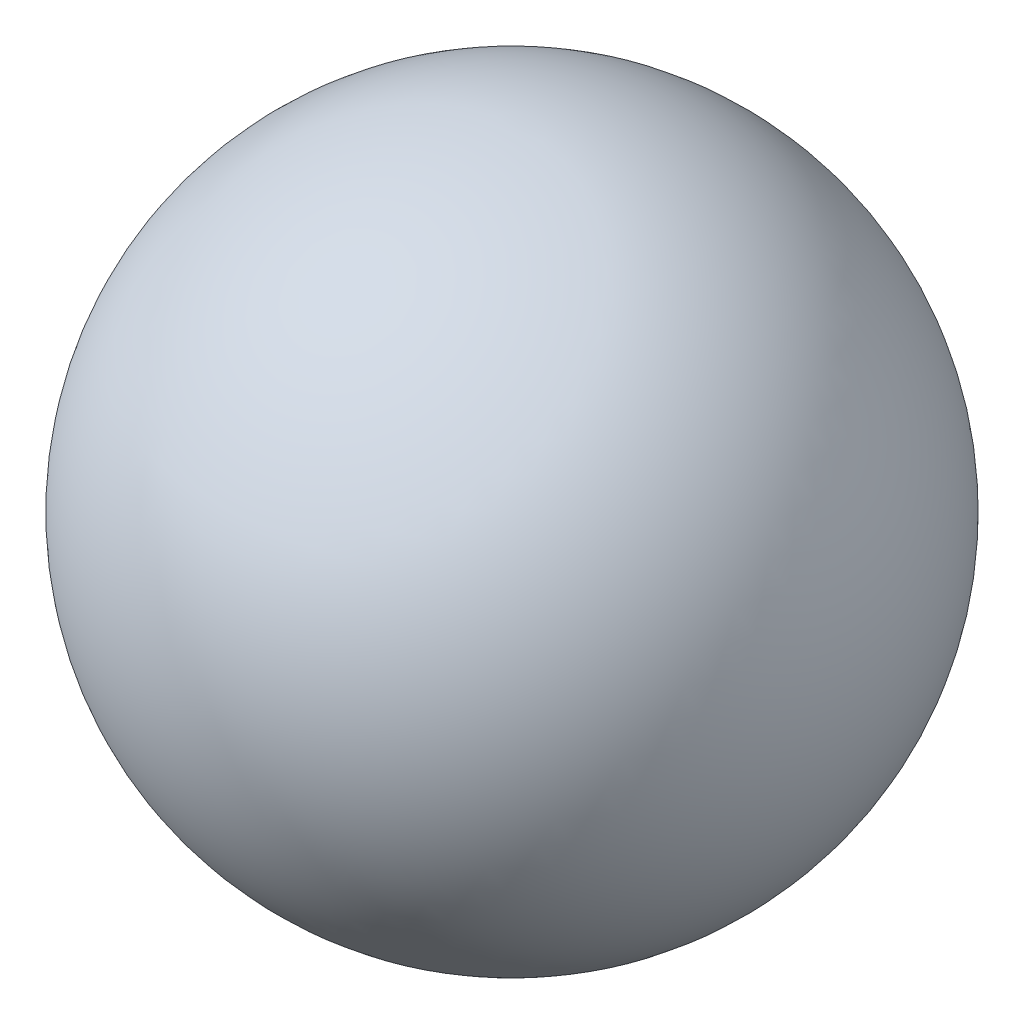
from build123d import *


with BuildPart() as part:
    # Szkic1 → Obrót2 (revolve)
    with BuildSketch(Plane.XY):
        with BuildLine():
            Line((0, -0.8), (0, 0.8))
            ThreePointArc((0, 0.8), (-0.8, 0), (0, -0.8))
        make_face()
    revolve(axis=Axis((0, 0, 0), (0, 1, 0)))


solid = part.part
